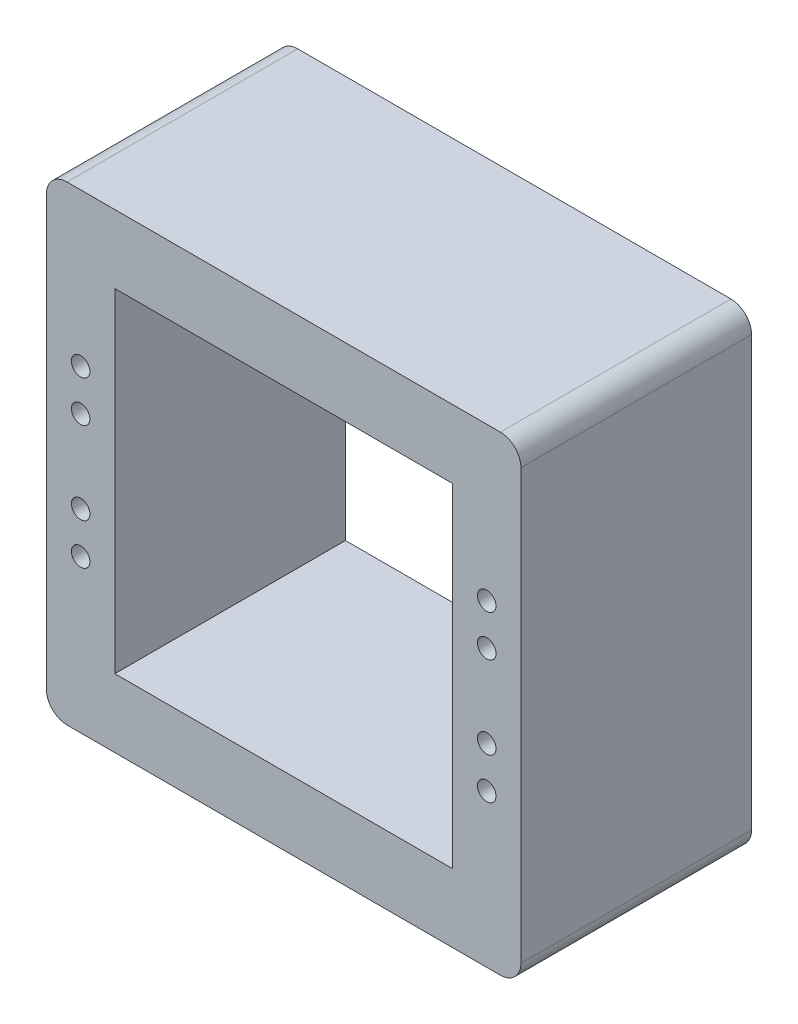
from build123d import *

# Parameters (mm, degrees)
SKETCH1_W           = 57.6
SKETCH1_H           = 57.1
SKETCH1_R           = 1.125
SKETCH1_W_2         = 41
SKETCH1_H_2         = 40.5
BOSS_EXTRUDE1_DEPTH = 28
FILLET1_R           = 2.5


with BuildPart() as part:
    # Sketch1 → Boss-Extrude1 (new body)
    with BuildSketch(Plane.XY):
        with Locations((20.5, 20.25)):
            Rectangle(SKETCH1_W, SKETCH1_H)
        with Locations((-4.15, 25.25)):
            Circle(SKETCH1_R, mode=Mode.SUBTRACT)
        with Locations((-4.15, 30.25)):
            Circle(SKETCH1_R, mode=Mode.SUBTRACT)
        with Locations(Location((-4.15, 10.25, 0), (0, 0, 180))):
            Circle(SKETCH1_R, mode=Mode.SUBTRACT)
        with Locations(Location((-4.15, 15.25, 0), (0, 0, 180))):
            Circle(SKETCH1_R, mode=Mode.SUBTRACT)
        with Locations((45.15, 15.25)):
            Circle(SKETCH1_R, mode=Mode.SUBTRACT)
        with Locations((45.15, 10.25)):
            Circle(SKETCH1_R, mode=Mode.SUBTRACT)
        with Locations(Location((45.15, 30.25, 0), (0, 0, 180))):
            Circle(SKETCH1_R, mode=Mode.SUBTRACT)
        with Locations(Location((45.15, 25.25, 0), (0, 0, 180))):
            Circle(SKETCH1_R, mode=Mode.SUBTRACT)
        with Locations((20.5, 20.25)):
            Rectangle(SKETCH1_W_2, SKETCH1_H_2, mode=Mode.SUBTRACT)
    extrude(amount=BOSS_EXTRUDE1_DEPTH)

    # Fillet1
    fillet1_edges = [part.edges().sort_by_distance(p)[0] for p in [
        (-8.3, 48.8, 14),
        (49.3, 48.8, 14),
        (49.3, -8.3, 14),
        (-8.3, -8.3, 14),
    ]]
    fillet(fillet1_edges, radius=FILLET1_R)


solid = part.part
